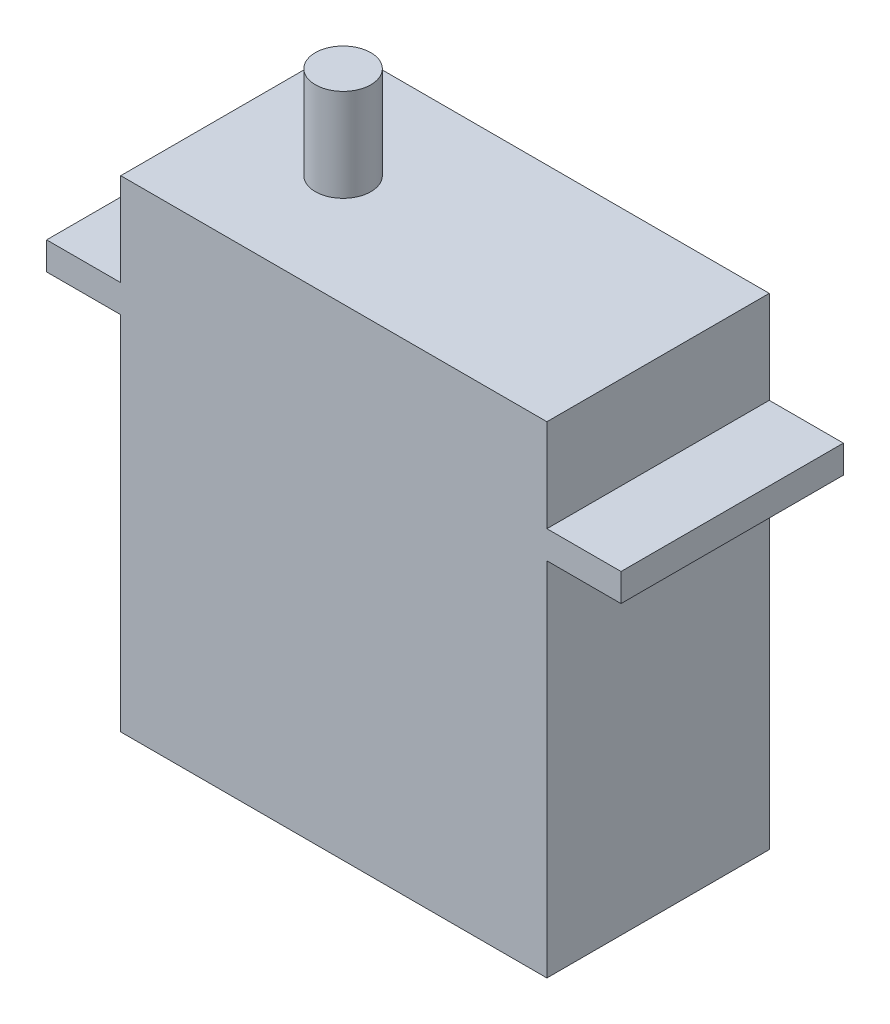
from build123d import *

# Parameters (mm, degrees)
SKETCH1_W           = 23
SKETCH1_H           = 12
BOSS_EXTRUDE1_DEPTH = 26
SKETCH2_W           = 12
SKETCH2_H           = 1.5
BOSS_EXTRUDE2_DEPTH = 4
SKETCH3_R           = 1.5
BOSS_EXTRUDE3_DEPTH = 5


with BuildPart() as part:
    # Sketch1 → Boss-Extrude1 (new body)
    with BuildSketch(Plane(origin=(0, 0, 0), x_dir=(1, 0, 0), z_dir=(0, 1, 0))):
        Rectangle(SKETCH1_W, SKETCH1_H)
    extrude(amount=BOSS_EXTRUDE1_DEPTH)

    # Sketch2 → Boss-Extrude2 (add)
    with BuildSketch(Plane(origin=(11.5, 0, 0), x_dir=(0, 0, -1), z_dir=(1, 0, 0))):
        with Locations((0, 20.25)):
            Rectangle(SKETCH2_W, SKETCH2_H)
    boss_extrude2 = extrude(amount=BOSS_EXTRUDE2_DEPTH)

    # Mirror1: Boss-Extrude2 across plane
    add(boss_extrude2.mirror(Plane(origin=(0, 0, 0), x_dir=(0, 0, 1), z_dir=(1, 0, 0))))

    # Sketch3 → Boss-Extrude3 (add)
    with BuildSketch(Plane(origin=(0, 26, 0), x_dir=(1, 0, 0), z_dir=(0, 1, 0))):
        with Locations(Location((-5.5, 0, 0), (0, 0, 270))):
            Circle(SKETCH3_R)
    extrude(amount=BOSS_EXTRUDE3_DEPTH)


solid = part.part
